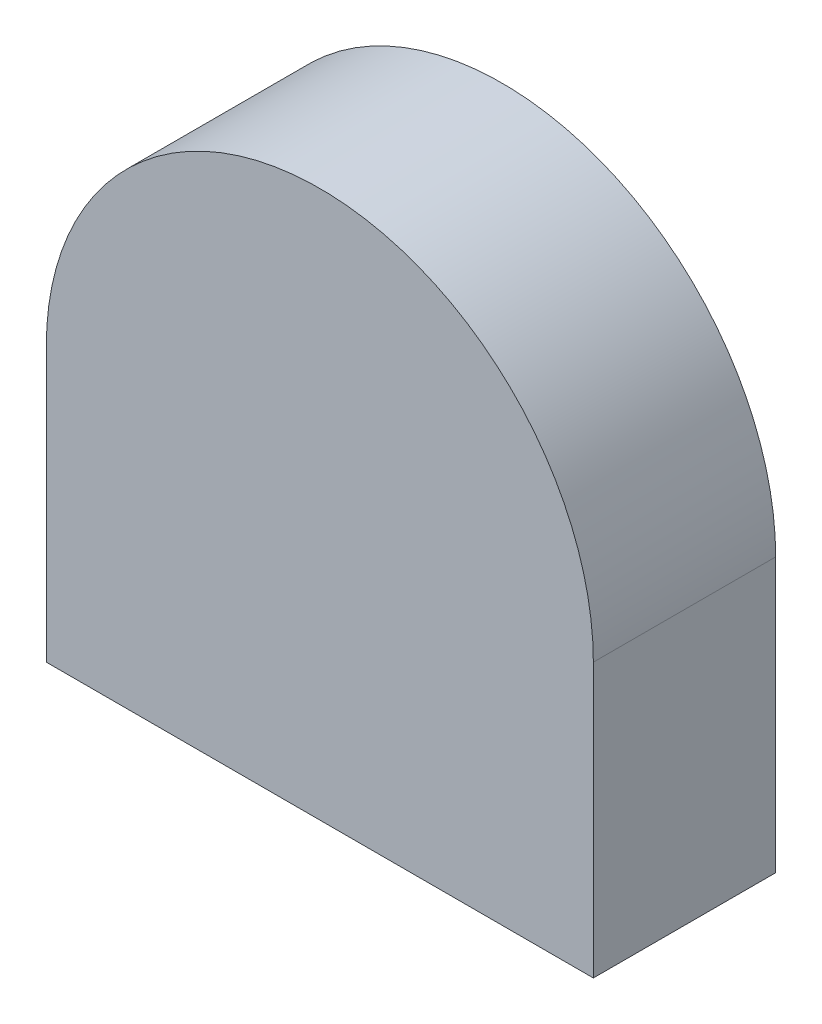
from build123d import *

# Parameters (mm, degrees)
SKETCH1_W           = 19.05
SKETCH1_H           = 9.525
BOSS_EXTRUDE1_DEPTH = 6.35


with BuildPart() as part:
    # Sketch1 → Boss-Extrude1 (new body)
    with BuildSketch(Plane.XY):
        with BuildLine():
            ThreePointArc((-8.504464286, 28.404910714), (1.020535714, 37.929910714), (10.545535714, 28.404910714))
            Line((10.545535714, 28.404910714), (-8.504464286, 28.404910714))
        make_face()
        with Locations((1.020535714, 23.642410714)):
            Rectangle(SKETCH1_W, SKETCH1_H)
    extrude(amount=BOSS_EXTRUDE1_DEPTH)


solid = part.part
